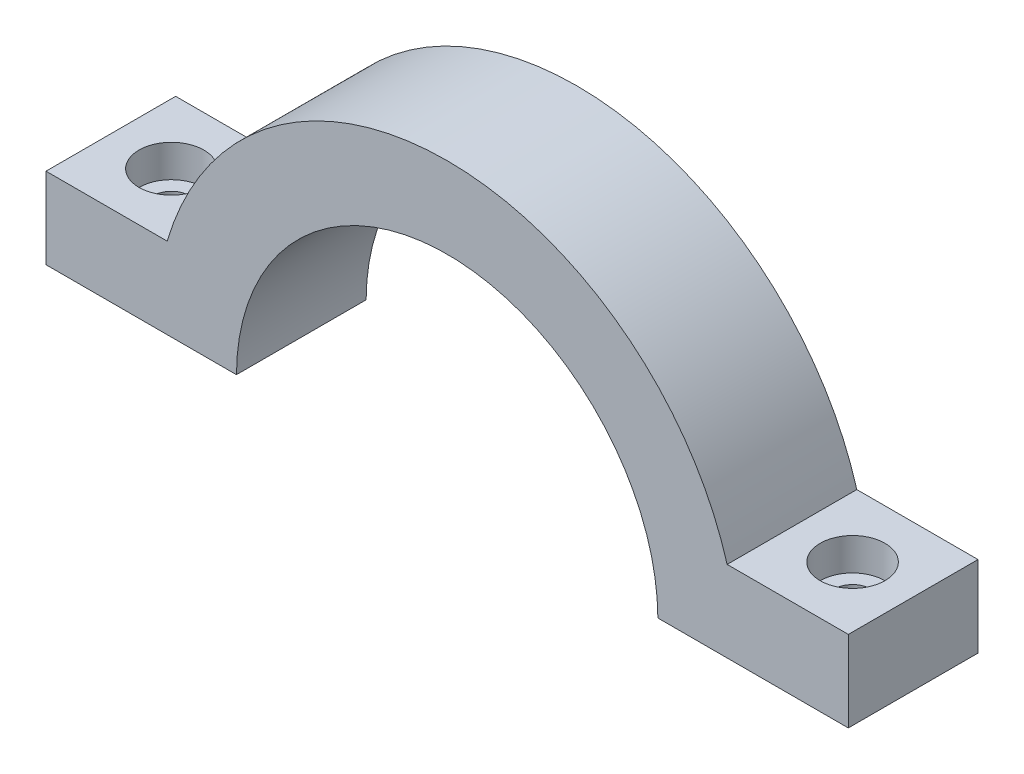
from build123d import *

# Parameters (mm, degrees)
BOSS_EXTRUDE1_DEPTH            = 16
CBORE_FOR_M4_SHCS1_D           = 4.5
CBORE_FOR_M4_SHCS1_CBORE_D     = 8
CBORE_FOR_M4_SHCS1_CBORE_DEPTH = 4


with BuildPart() as part:
    # Sketch2 → Boss-Extrude1 (new body)
    with BuildSketch(Plane.XY):
        with BuildLine():
            Line((-49.5, 0.125), (-25.999699517, 0.125))
            ThreePointArc((-25.999699517, 0.125), (0, 26), (25.999699517, 0.125))
            Line((25.999699517, 0.125), (49.5, 0.125))
            Line((49.5, 0.125), (49.5, 10.125))
            Line((49.5, 10.125), (34.546843199, 10.125))
            ThreePointArc((34.546843199, 10.125), (0, 36), (-34.546843199, 10.125))
            Line((-34.546843199, 10.125), (-49.5, 10.125))
            Line((-49.5, 10.125), (-49.5, 0.125))
        make_face()
    extrude(amount=-BOSS_EXTRUDE1_DEPTH)

    # CBORE for M4 SHCS1 (through all)
    with Locations(Plane(origin=(0, 10.125, 0), x_dir=(1, 0, 0), z_dir=(0, 1, 0))):
        with Locations((-42.023421599, 8), (42.023421599, 8)):
            CounterBoreHole(CBORE_FOR_M4_SHCS1_D / 2, CBORE_FOR_M4_SHCS1_CBORE_D / 2, CBORE_FOR_M4_SHCS1_CBORE_DEPTH)


solid = part.part
